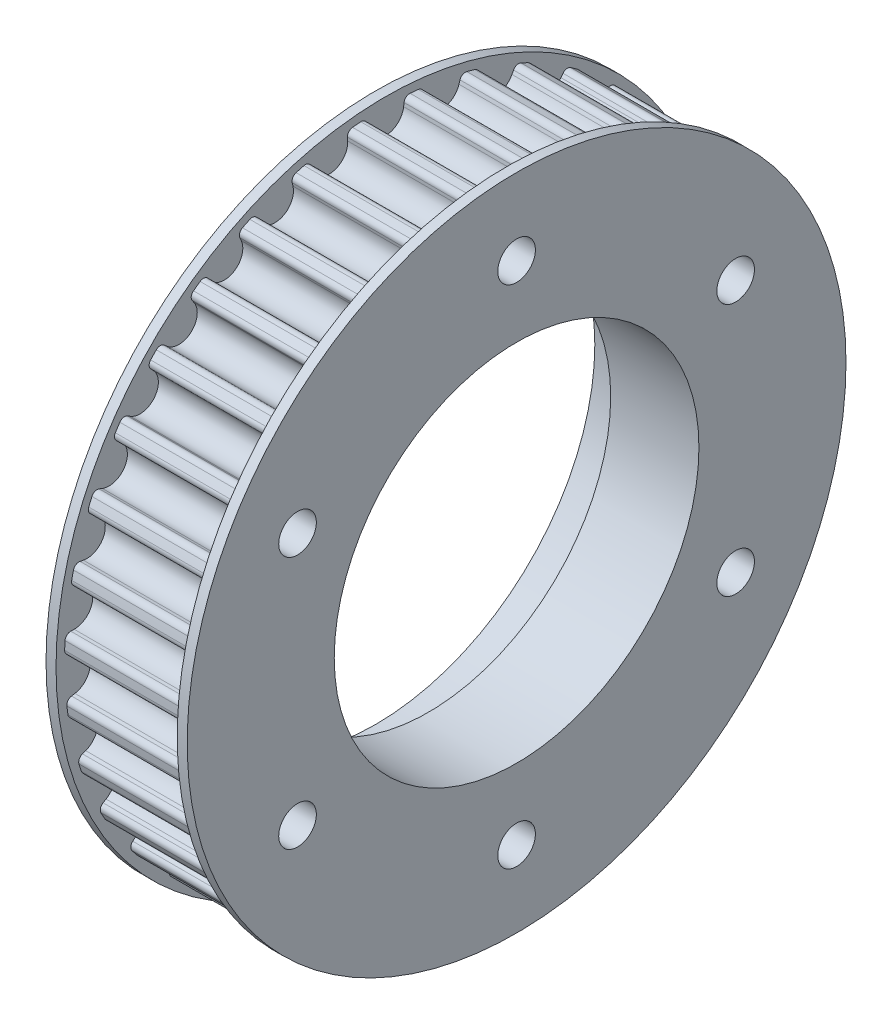
from build123d import *

# Parameters (mm, degrees)
SKETCH_1_W               = 10.3
SKETCH_1_H               = 27.278
CUT_EXTRUDE_2_REACH      = 41.928
PATTERN_CIRCULAR_3_COUNT = 35
SKETCH_7_R               = 28
EXTRUDE_1_DEPTH          = 0.85
EXTRUDE_START            = 0.85
SKETCH_8_R               = 28
EXTRUDE_2_DEPTH          = 0.85
SKETCH_9_R               = 18.65
CUT_EXTRUDE_3_DEPTH      = 4
SKETCH_10_R              = 17.5
CUT_EXTRUDE_4_DEPTH      = 0.5
SKETCH_11_R              = 1.6
CUT_EXTRUDE_5_DEPTH      = 42.376321731
SKETCH_12_R              = 15.5
CUT_EXTRUDE_6_DEPTH      = 41.301985063


with BuildPart() as part:
    # 草图1 → 旋转1 (revolve)
    with BuildSketch(Plane.XY):
        with Locations((5.15, 13.639)):
            Rectangle(SKETCH_1_W, SKETCH_1_H)
    revolve(axis=Axis((0, 0, 0), (1, 0, 0)))

    # 草图6 → 切除-拉伸2 (cut, up to next)
    with BuildSketch(Plane(origin=(0, 0, 0), x_dir=(0, 0, -1), z_dir=(1, 0, 0)), mode=Mode.PRIVATE) as cut_extrude_2_sk1:
        with BuildLine():
            Line((1.583892871, 26.777178128), (1.548371997, 26.487883824))
            ThreePointArc((1.548371997, 26.487883824), (0, 25.118), (-1.548371997, 26.487883824))
            Line((-1.548371997, 26.487883824), (-1.583892871, 26.777178128))
            ThreePointArc((-1.583892871, 26.777178128), (-1.756322779, 27.090149167), (-2.097218942, 27.197260096))
            ThreePointArc((-2.097218942, 27.197260096), (-2.346390889, 27.17689706), (-2.595365746, 27.154251244))
            Line((-2.595365746, 27.154251244), (-2.792013735, 28.755820587))
            ThreePointArc((-2.792013735, 28.755820587), (0, 28.891046335), (2.792013735, 28.755820587))
            Line((2.792013735, 28.755820587), (2.595365746, 27.154251244))
            ThreePointArc((2.595365746, 27.154251244), (2.346390889, 27.17689706), (2.097218942, 27.197260096))
            ThreePointArc((2.097218942, 27.197260096), (1.756322779, 27.090149167), (1.583892871, 26.777178128))
        make_face()
    cut_extrude_2_tool1 = extrude(cut_extrude_2_sk1.sketch, amount=CUT_EXTRUDE_2_REACH, mode=Mode.PRIVATE) & part.part
    cut_extrude_2 = cut_extrude_2_tool1.solids().sort_by_distance((0, 27.368813, 0))[0]
    add(cut_extrude_2, mode=Mode.SUBTRACT)

    # 阵列(圆周)3: 切除-拉伸2 ×35 about axis
    pattern_circular_3_axis = Axis((-1.4, 0, 0), (1, 0, 0))
    for i in range(1, PATTERN_CIRCULAR_3_COUNT):
        add(cut_extrude_2.rotate(pattern_circular_3_axis, i * 360 / PATTERN_CIRCULAR_3_COUNT), mode=Mode.SUBTRACT)

    # 草图7 → 凸台-拉伸1 (add)
    with BuildSketch(Plane(origin=(10.3, 0, 0), x_dir=(0, 0, -1), z_dir=(1, 0, 0))):
        Circle(SKETCH_7_R)
    extrude(amount=EXTRUDE_1_DEPTH)

    # 草图8 → 凸台-拉伸2 (add)
    with BuildSketch(Plane.ZY.offset(EXTRUDE_START)):
        Circle(SKETCH_8_R)
    extrude(amount=-EXTRUDE_2_DEPTH)

    # 草图9 → 切除-拉伸3 (cut)
    with BuildSketch(Plane.ZY.offset(0.85)):
        Circle(SKETCH_9_R)
    extrude(amount=-CUT_EXTRUDE_3_DEPTH, mode=Mode.SUBTRACT)

    # 草图10 → 切除-拉伸4 (cut)
    with BuildSketch(Plane.ZY.offset(-3.15)):
        Circle(SKETCH_10_R)
    extrude(amount=-CUT_EXTRUDE_4_DEPTH, mode=Mode.SUBTRACT)

    # 草图11 → 切除-拉伸5 (cut, through all)
    with BuildSketch(Plane.ZY.offset(0.85)):
        with Locations((0, 21.5)):
            Circle(SKETCH_11_R)
        with Locations((18.619546181, 10.75)):
            Circle(SKETCH_11_R)
        with Locations((18.619546181, -10.75)):
            Circle(SKETCH_11_R)
        with Locations((0, -21.5)):
            Circle(SKETCH_11_R)
        with Locations((-18.619546181, -10.75)):
            Circle(SKETCH_11_R)
        with Locations((-18.619546181, 10.75)):
            Circle(SKETCH_11_R)
    extrude(amount=-CUT_EXTRUDE_5_DEPTH, mode=Mode.SUBTRACT)

    # 草图12 → 切除-拉伸6 (cut, through all)
    with BuildSketch(Plane.ZY.offset(-3.65)):
        Circle(SKETCH_12_R)
    extrude(amount=-CUT_EXTRUDE_6_DEPTH, mode=Mode.SUBTRACT)


solid = part.part
